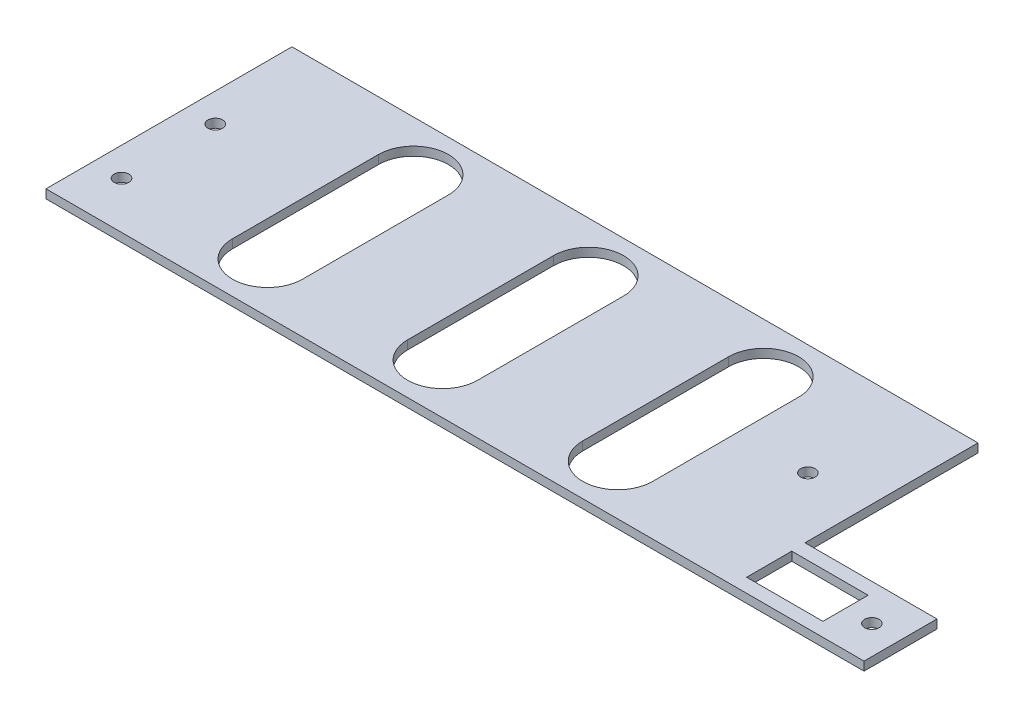
from build123d import *

# Parameters (mm, degrees)
ESQUISSE1_R             = 2.5
BOSS_EXTRU_1_DEPTH      = 3
ESQUISSE2_W             = 20
ESQUISSE2_H             = 10
ENL_V_MAT_EXTRU_1_DEPTH = 174.720827721
SKETCH1_W               = 235.08624341
SKETCH1_H               = 3
BOSS_EXTRUDE1_DEPTH     = 20
CUT_EXTRUDE1_DEPTH      = 10
SKETCH3_W               = 20
SKETCH3_H               = 2.74057888
CUT_EXTRUDE2_DEPTH      = 10


with BuildPart() as part:
    # Esquisse1 → Boss.-Extru.1 (new body)
    with BuildSketch(Plane(origin=(0, 0, 0), x_dir=(1, 0, 0), z_dir=(0, 1, 0))):
        Polygon((-170.028456395, 18.77), (-170.028456395, -23), (-170.028456395, -35.5), (110.271543605, -35.5), (110.271543605, -10.5), (65.057787015, -10.5), (65.057787015, 28.77), (-170.028456395, 28.77), align=None)
        with Locations(Location((100.471543605, -23, 0), (0, 0, 270))):
            Circle(ESQUISSE1_R, mode=Mode.SUBTRACT)
        with Locations(Location((-160.228456395, -19.4325, 0), (0, 0, 270))):
            Circle(ESQUISSE1_R, mode=Mode.SUBTRACT)
        with Locations(Location((-160.228456395, 12.7025, 0), (0, 0, 270))):
            Circle(ESQUISSE1_R, mode=Mode.SUBTRACT)
        with Locations(Location((44.807787015, 10.747499922, 0), (0, 0, 270))):
            Circle(ESQUISSE1_R, mode=Mode.SUBTRACT)
    extrude(amount=BOSS_EXTRU_1_DEPTH)

    # Esquisse2 → Enlèv. mat.-Extru.1 (cut, through all)
    with BuildSketch(Plane(origin=(0, 3, 0), x_dir=(1, 0, 0), z_dir=(0, 1, 0))):
        with BuildLine():
            Line((-113.756895542, 11.635), (-113.756895542, -18.365))
            ThreePointArc((-113.756895542, -18.365), (-111.256895542, -20.865), (-108.756895542, -18.365))
            Line((-108.756895542, -18.365), (-108.756895542, 11.635))
            ThreePointArc((-108.756895542, 11.635), (-111.256895542, 14.135), (-113.756895542, 11.635))
        make_face()
        with BuildLine():
            Line((-54.98533469, 11.635), (-54.98533469, -18.365))
            ThreePointArc((-54.98533469, -18.365), (-52.48533469, -20.865), (-49.98533469, -18.365))
            Line((-49.98533469, -18.365), (-49.98533469, 11.635))
            ThreePointArc((-49.98533469, 11.635), (-52.48533469, 14.135), (-54.98533469, 11.635))
        make_face()
        with BuildLine():
            Line((3.786226163, 11.635), (3.786226163, -18.365))
            ThreePointArc((3.786226163, -18.365), (6.286226163, -20.865), (8.786226163, -18.365))
            Line((8.786226163, -18.365), (8.786226163, 11.635))
            ThreePointArc((8.786226163, 11.635), (6.286226163, 14.135), (3.786226163, 11.635))
        make_face()
        with Locations((75.271543605, -23)):
            Rectangle(ESQUISSE2_W, ESQUISSE2_H)
    extrude(amount=-ENL_V_MAT_EXTRU_1_DEPTH, mode=Mode.SUBTRACT)

    # Sketch1 → Boss-Extrude1 (add)
    with BuildSketch(Plane(origin=(0, 0, -28.77), x_dir=(-1, 0, 0), z_dir=(0, 0, -1))):
        with Locations((52.48533469, 1.5)):
            Rectangle(SKETCH1_W, SKETCH1_H)
    extrude(amount=BOSS_EXTRUDE1_DEPTH)

    # Sketch2 → Cut-Extrude1 (cut)
    with BuildSketch(Plane(origin=(0, 0, 0), x_dir=(-1, 0, 0), z_dir=(0, -1, 0))):
        with BuildLine():
            Line((99.256895542, -18.365), (99.256895542, 31.635))
            ThreePointArc((99.256895542, 31.635), (111.256895542, 43.635), (123.256895542, 31.635))
            Line((123.256895542, 31.635), (123.256895542, -18.365))
            ThreePointArc((123.256895542, -18.365), (111.256895542, -30.365), (99.256895542, -18.365))
        make_face()
        with BuildLine():
            Line((39.256895542, -18.365), (39.256895542, 31.635))
            ThreePointArc((39.256895542, 31.635), (51.256895542, 43.635), (63.256895542, 31.635))
            Line((63.256895542, 31.635), (63.256895542, -18.365))
            ThreePointArc((63.256895542, -18.365), (51.256895542, -30.365), (39.256895542, -18.365))
        make_face()
        with BuildLine():
            Line((-20.743104458, -18.365), (-20.743104458, 31.635))
            ThreePointArc((-20.743104458, 31.635), (-8.743104458, 43.635), (3.256895542, 31.635))
            Line((3.256895542, 31.635), (3.256895542, -18.365))
            ThreePointArc((3.256895542, -18.365), (-8.743104458, -30.365), (-20.743104458, -18.365))
        make_face()
    extrude(amount=-CUT_EXTRUDE1_DEPTH, mode=Mode.SUBTRACT)

    # Sketch3 → Cut-Extrude2 (cut)
    with BuildSketch(Plane(origin=(0, 3, 0), x_dir=(1, 0, 0), z_dir=(0, 1, 0))):
        Polygon((85.271543605, -28), (85.271543605, -30.74057888), (91.436540381, -30.74057888), (91.436540381, -15.25942112), (85.271543605, -15.25942112), (85.271543605, -18), align=None)
        with Locations((75.271543605, -16.62971056)):
            Rectangle(SKETCH3_W, SKETCH3_H)
        with Locations((75.271543605, -29.37028944)):
            Rectangle(SKETCH3_W, SKETCH3_H)
    extrude(amount=-CUT_EXTRUDE2_DEPTH, mode=Mode.SUBTRACT)


solid = part.part
